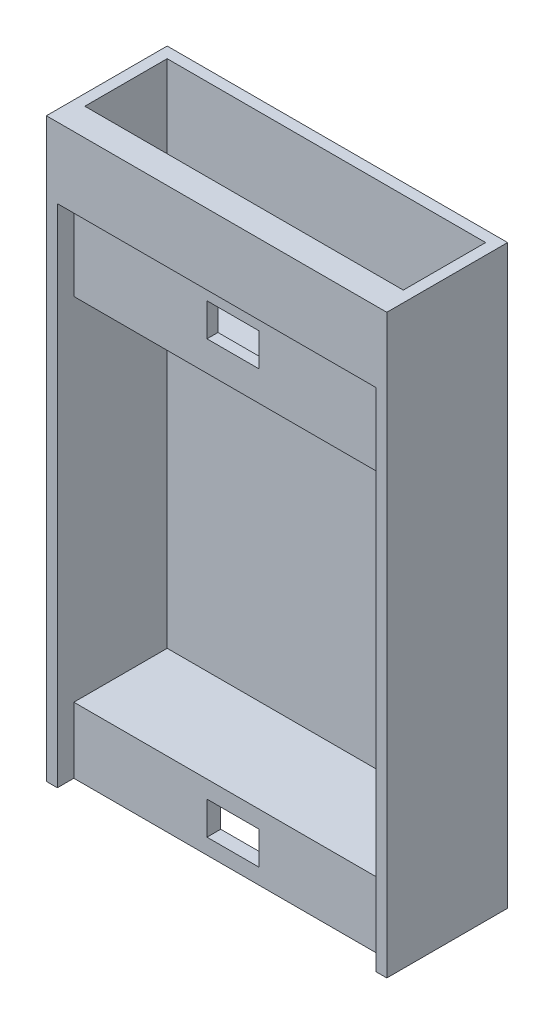
from build123d import *

# Parameters (mm, degrees)
SKETCH1_W           = 62
SKETCH1_H           = 78
BOSS_EXTRUDE1_DEPTH = 2
SKETCH2_W           = 62
SKETCH2_H           = 78
SKETCH2_W_2         = 58
SKETCH2_H_2         = 64
BOSS_EXTRUDE2_DEPTH = 20
CUT_EXTRUDE1_REACH  = 86.481
SKETCH3_R           = 3.313142946
SKETCH4_W           = 62
SKETCH4_H           = 27
BOSS_EXTRUDE3_DEPTH = 2
SKETCH5_W           = 2
SKETCH5_H           = 27
BOSS_EXTRUDE4_DEPTH = 20
SKETCH6_W           = 58
SKETCH6_H           = 27
BOSS_EXTRUDE5_DEPTH = 2
SKETCH9_W           = 57.873853322
SKETCH9_H           = 10
CUT_EXTRUDE4_DEPTH  = 14.5
SKETCH12_W          = 58
SKETCH12_H          = 27
BOSS_EXTRUDE6_DEPTH = 3
SKETCH13_W          = 58
SKETCH13_H          = 92.14389058
CUT_EXTRUDE6_DEPTH  = 3
CUT_EXTRUDE7_REACH  = 77.353
SKETCH14_W          = 9.5
SKETCH14_H          = 6


with BuildPart() as part:
    # Sketch1 → Boss-Extrude1 (new body)
    with BuildSketch(Plane.XY):
        Rectangle(SKETCH1_W, SKETCH1_H)
    extrude(amount=-BOSS_EXTRUDE1_DEPTH)

    # Sketch2 → Boss-Extrude2 (add)
    with BuildSketch(Plane.XY):
        Rectangle(SKETCH2_W, SKETCH2_H)
        with Locations((0, 5)):
            Rectangle(SKETCH2_W_2, SKETCH2_H_2, mode=Mode.SUBTRACT)
    extrude(amount=BOSS_EXTRUDE2_DEPTH)

    # Sketch3 → Cut-Extrude1 (cut, up to next)
    with BuildSketch(Plane.XZ.offset(-37), mode=Mode.PRIVATE) as cut_extrude1_sk1:
        with Locations((-20.488158498, 8.767623766)):
            Circle(SKETCH3_R)
    cut_extrude1_tool1 = extrude(cut_extrude1_sk1.sketch, amount=-CUT_EXTRUDE1_REACH, mode=Mode.PRIVATE) & part.part
    add(cut_extrude1_tool1.solids().sort_by_distance((-20.488158, 37, 8.767624))[0], mode=Mode.SUBTRACT)

    # Sketch4 → Boss-Extrude3 (add)
    with BuildSketch(Plane.XY):
        with Locations((0, 52.5)):
            Rectangle(SKETCH4_W, SKETCH4_H)
    extrude(amount=-BOSS_EXTRUDE3_DEPTH)

    # Sketch5 → Boss-Extrude4 (add)
    with BuildSketch(Plane.XY):
        with Locations((-30, 52.5)):
            Rectangle(SKETCH5_W, SKETCH5_H)
        with Locations((30, 52.5)):
            Rectangle(SKETCH5_W, SKETCH5_H)
    extrude(amount=BOSS_EXTRUDE4_DEPTH)

    # Sketch6 → Boss-Extrude5 (add)
    with BuildSketch(Plane.XY.offset(20)):
        with Locations((0, 52.5)):
            Rectangle(SKETCH6_W, SKETCH6_H)
    extrude(amount=-BOSS_EXTRUDE5_DEPTH)

    # Sketch9 → Cut-Extrude4 (cut)
    with BuildSketch(Plane.XY):
        with Locations((-0.063073339, -34)):
            Rectangle(SKETCH9_W, SKETCH9_H)
    extrude(amount=CUT_EXTRUDE4_DEPTH, mode=Mode.SUBTRACT)

    # Sketch12 → Boss-Extrude6 (add)
    with BuildSketch(Plane(origin=(0, 0, 18), x_dir=(-1, 0, 0), z_dir=(0, 0, -1))):
        with Locations((0, 52.5)):
            Rectangle(SKETCH12_W, SKETCH12_H)
    extrude(amount=BOSS_EXTRUDE6_DEPTH)

    # Sketch13 → Cut-Extrude6 (cut)
    with BuildSketch(Plane.XY.offset(20)):
        with Locations((0, 7.07194529)):
            Rectangle(SKETCH13_W, SKETCH13_H)
    extrude(amount=-CUT_EXTRUDE6_DEPTH, mode=Mode.SUBTRACT)

    # Cut-Extrude7: up to this face of the body (flat: up to its plane)
    cut_extrude7_end = Plane(part.part.faces().sort_by_distance((-0.063073339, -34, 0))[0])
    # Sketch14 → Cut-Extrude7 (cut, up to the picked face)
    with BuildSketch(Plane.XY.offset(17), mode=Mode.PRIVATE) as cut_extrude7_sk1:
        with Locations((0, 45.439187808)):
            Rectangle(SKETCH14_W, SKETCH14_H)
    cut_extrude7_tool1 = split(extrude(cut_extrude7_sk1.sketch, amount=-CUT_EXTRUDE7_REACH, mode=Mode.PRIVATE), bisect_by=cut_extrude7_end, keep=Keep.BOTH, mode=Mode.PRIVATE)
    # Sketch14 → Cut-Extrude7 (cut, up to the picked face)
    with BuildSketch(Plane.XY.offset(17), mode=Mode.PRIVATE) as cut_extrude7_sk2:
        with Locations((0, -33.160812192)):
            Rectangle(SKETCH14_W, SKETCH14_H)
    cut_extrude7_tool2 = split(extrude(cut_extrude7_sk2.sketch, amount=-CUT_EXTRUDE7_REACH, mode=Mode.PRIVATE), bisect_by=cut_extrude7_end, keep=Keep.BOTH, mode=Mode.PRIVATE)
    add(cut_extrude7_tool1.solids().sort_by(Axis((0, 45.439188, 17), (0, 0, -1)))[0], mode=Mode.SUBTRACT)
    add(cut_extrude7_tool2.solids().sort_by(Axis((0, -33.160812, 17), (0, 0, -1)))[0], mode=Mode.SUBTRACT)


solid = part.part
